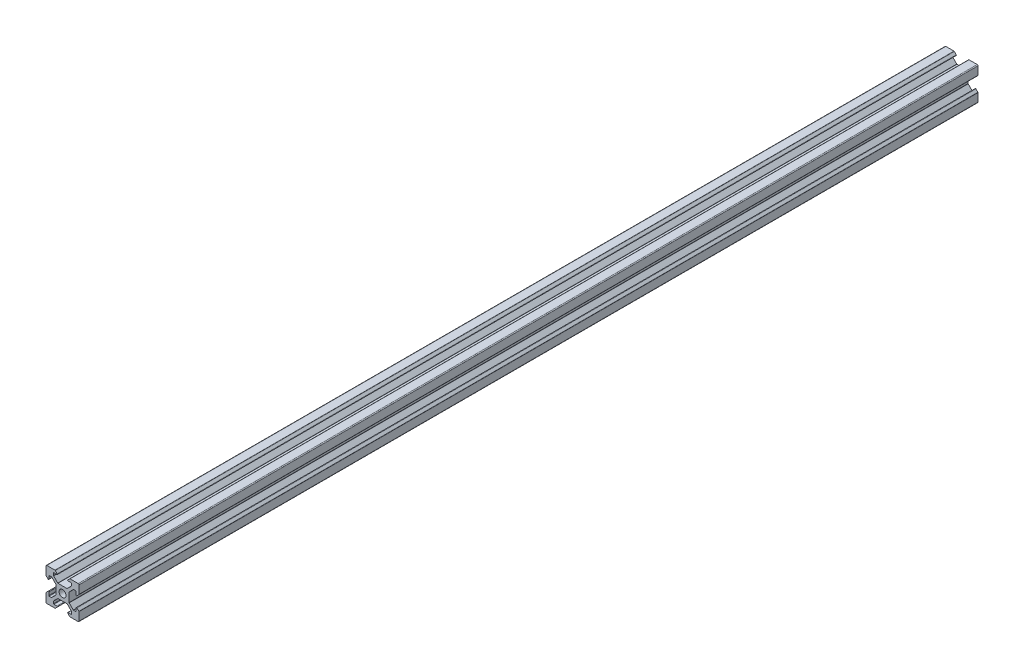
from build123d import *

# Parameters (mm, degrees)
MODEL_R             = 2.1
BOSS_EXTRUDE1_DEPTH = 545


with BuildPart() as part:
    # Model → Boss-Extrude1 (new body)
    with BuildSketch(Plane.XY):
        with BuildLine():
            Line((2012.931211125, 1381.800393717), (2012.931211125, 1378.200393717))
            Line((2012.931211125, 1378.200393717), (2012.931211125, 1377.300429431))
            ThreePointArc((2012.931211125, 1377.300429431), (2012.908374985, 1377.185624401), (2012.843343159, 1377.088297396))
            Line((2012.843343159, 1377.088297396), (2010.378662785, 1374.623617022))
            ThreePointArc((2010.378662785, 1374.623617022), (2010.297556948, 1374.569423834), (2010.20188609, 1374.550393717))
            Line((2010.20188609, 1374.550393717), (2008.881211125, 1374.550393717))
            ThreePointArc((2008.881211125, 1374.550393717), (2008.70443443, 1374.623617022), (2008.631211125, 1374.800393717))
            Line((2008.631211125, 1374.800393717), (2008.631211125, 1376.650393717))
            ThreePointArc((2008.631211125, 1376.650393717), (2008.476881983, 1376.8813636), (2008.20443443, 1376.827170412))
            Line((2008.20443443, 1376.827170412), (2007.01907909, 1375.641815073))
            ThreePointArc((2007.01907909, 1375.641815073), (2006.954047265, 1375.544488069), (2006.931211125, 1375.429683039))
            Line((2006.931211125, 1375.429683039), (2006.931211125, 1370.500393717))
            ThreePointArc((2006.931211125, 1370.500393717), (2007.077657734, 1370.146840327), (2007.431211125, 1370.000393717))
            Line((2007.431211125, 1370.000393717), (2012.360500447, 1370.000393717))
            ThreePointArc((2012.360500447, 1370.000393717), (2012.475305476, 1370.023229857), (2012.572632481, 1370.088261683))
            Line((2012.572632481, 1370.088261683), (2013.75798782, 1371.273617022))
            ThreePointArc((2013.75798782, 1371.273617022), (2013.812181008, 1371.546064575), (2013.581211125, 1371.700393717))
            Line((2013.581211125, 1371.700393717), (2011.731211125, 1371.700393717))
            ThreePointArc((2011.731211125, 1371.700393717), (2011.55443443, 1371.773617022), (2011.481211125, 1371.950393717))
            Line((2011.481211125, 1371.950393717), (2011.481211125, 1373.271068682))
            ThreePointArc((2011.481211125, 1373.271068682), (2011.500241242, 1373.36673954), (2011.55443443, 1373.447845377))
            Line((2011.55443443, 1373.447845377), (2014.033759465, 1375.927170412))
            ThreePointArc((2014.033759465, 1375.927170412), (2014.114865302, 1375.9813636), (2014.21053616, 1376.000393717))
            Line((2014.21053616, 1376.000393717), (2016.470233902, 1376.000393717))
            Line((2016.470233902, 1376.000393717), (2017.392188348, 1376.000393717))
            Line((2017.392188348, 1376.000393717), (2019.65188609, 1376.000393717))
            ThreePointArc((2019.65188609, 1376.000393717), (2019.747556948, 1375.9813636), (2019.828662785, 1375.927170412))
            Line((2019.828662785, 1375.927170412), (2022.30798782, 1373.447845377))
            ThreePointArc((2022.30798782, 1373.447845377), (2022.362181008, 1373.36673954), (2022.381211125, 1373.271068682))
            Line((2022.381211125, 1373.271068682), (2022.381211125, 1371.950393717))
            ThreePointArc((2022.381211125, 1371.950393717), (2022.30798782, 1371.773617022), (2022.131211125, 1371.700393717))
            Line((2022.131211125, 1371.700393717), (2020.281211125, 1371.700393717))
            ThreePointArc((2020.281211125, 1371.700393717), (2020.050241242, 1371.546064575), (2020.10443443, 1371.273617022))
            Line((2020.10443443, 1371.273617022), (2021.289789769, 1370.088261683))
            ThreePointArc((2021.289789769, 1370.088261683), (2021.387116773, 1370.023229857), (2021.501921803, 1370.000393717))
            Line((2021.501921803, 1370.000393717), (2026.431211125, 1370.000393717))
            ThreePointArc((2026.431211125, 1370.000393717), (2026.784764515, 1370.146840327), (2026.931211125, 1370.500393717))
            Line((2026.931211125, 1370.500393717), (2026.931211125, 1375.429683039))
            ThreePointArc((2026.931211125, 1375.429683039), (2026.908374985, 1375.544488069), (2026.843343159, 1375.641815073))
            Line((2026.843343159, 1375.641815073), (2025.65798782, 1376.827170412))
            ThreePointArc((2025.65798782, 1376.827170412), (2025.385540267, 1376.8813636), (2025.231211125, 1376.650393717))
            Line((2025.231211125, 1376.650393717), (2025.231211125, 1374.800393717))
            ThreePointArc((2025.231211125, 1374.800393717), (2025.15798782, 1374.623617022), (2024.981211125, 1374.550393717))
            Line((2024.981211125, 1374.550393717), (2023.66053616, 1374.550393717))
            ThreePointArc((2023.66053616, 1374.550393717), (2023.564865302, 1374.569423834), (2023.483759465, 1374.623617022))
            Line((2023.483759465, 1374.623617022), (2021.00443443, 1377.102942057))
            ThreePointArc((2021.00443443, 1377.102942057), (2020.950241242, 1377.184047894), (2020.931211125, 1377.279718752))
            Line((2020.931211125, 1377.279718752), (2020.931211125, 1379.539416494))
            Line((2020.931211125, 1379.539416494), (2020.931211125, 1380.46137094))
            Line((2020.931211125, 1380.46137094), (2020.931211125, 1382.721068682))
            ThreePointArc((2020.931211125, 1382.721068682), (2020.950241242, 1382.81673954), (2021.00443443, 1382.897845377))
            Line((2021.00443443, 1382.897845377), (2023.483759465, 1385.377170412))
            ThreePointArc((2023.483759465, 1385.377170412), (2023.564865302, 1385.4313636), (2023.66053616, 1385.450393717))
            Line((2023.66053616, 1385.450393717), (2024.981211125, 1385.450393717))
            ThreePointArc((2024.981211125, 1385.450393717), (2025.15798782, 1385.377170412), (2025.231211125, 1385.200393717))
            Line((2025.231211125, 1385.200393717), (2025.231211125, 1383.350393717))
            ThreePointArc((2025.231211125, 1383.350393717), (2025.385540267, 1383.119423834), (2025.65798782, 1383.173617022))
            Line((2025.65798782, 1383.173617022), (2026.843343159, 1384.358972361))
            ThreePointArc((2026.843343159, 1384.358972361), (2026.908374985, 1384.456299366), (2026.931211125, 1384.571104395))
            Line((2026.931211125, 1384.571104395), (2026.931211125, 1389.500393717))
            ThreePointArc((2026.931211125, 1389.500393717), (2026.784764516, 1389.853947108), (2026.431211125, 1390.000393717))
            Line((2026.431211125, 1390.000393717), (2021.501921803, 1390.000393717))
            ThreePointArc((2021.501921803, 1390.000393717), (2021.387116773, 1389.977557577), (2021.289789769, 1389.912525752))
            Line((2021.289789769, 1389.912525752), (2020.10443443, 1388.727170413))
            ThreePointArc((2020.10443443, 1388.727170413), (2020.050241242, 1388.454722859), (2020.281211125, 1388.300393717))
            Line((2020.281211125, 1388.300393717), (2022.131211125, 1388.300393717))
            ThreePointArc((2022.131211125, 1388.300393717), (2022.30798782, 1388.227170413), (2022.381211125, 1388.050393717))
            Line((2022.381211125, 1388.050393717), (2022.381211125, 1386.729718752))
            ThreePointArc((2022.381211125, 1386.729718752), (2022.362181008, 1386.634047894), (2022.30798782, 1386.552942057))
            Line((2022.30798782, 1386.552942057), (2019.828662785, 1384.073617022))
            ThreePointArc((2019.828662785, 1384.073617022), (2019.747556948, 1384.019423834), (2019.65188609, 1384.000393717))
            Line((2019.65188609, 1384.000393717), (2017.392188348, 1384.000393717))
            Line((2017.392188348, 1384.000393717), (2016.470233902, 1384.000393717))
            Line((2016.470233902, 1384.000393717), (2014.21053616, 1384.000393717))
            ThreePointArc((2014.21053616, 1384.000393717), (2014.114865302, 1384.019423834), (2014.033759465, 1384.073617022))
            Line((2014.033759465, 1384.073617022), (2011.55443443, 1386.552942057))
            ThreePointArc((2011.55443443, 1386.552942057), (2011.500241242, 1386.634047894), (2011.481211125, 1386.729718752))
            Line((2011.481211125, 1386.729718752), (2011.481211125, 1388.050393717))
            ThreePointArc((2011.481211125, 1388.050393717), (2011.55443443, 1388.227170413), (2011.731211125, 1388.300393717))
            Line((2011.731211125, 1388.300393717), (2013.581211125, 1388.300393717))
            ThreePointArc((2013.581211125, 1388.300393717), (2013.812181008, 1388.454722859), (2013.75798782, 1388.727170413))
            Line((2013.75798782, 1388.727170413), (2012.572632481, 1389.912525752))
            ThreePointArc((2012.572632481, 1389.912525752), (2012.475305477, 1389.977557577), (2012.360500447, 1390.000393717))
            Line((2012.360500447, 1390.000393717), (2007.431211125, 1390.000393717))
            ThreePointArc((2007.431211125, 1390.000393717), (2007.077657734, 1389.853947108), (2006.931211125, 1389.500393717))
            Line((2006.931211125, 1389.500393717), (2006.931211125, 1384.571104395))
            ThreePointArc((2006.931211125, 1384.571104395), (2006.954047265, 1384.456299366), (2007.019079091, 1384.358972361))
            Line((2007.019079091, 1384.358972361), (2008.20443443, 1383.173617022))
            ThreePointArc((2008.20443443, 1383.173617022), (2008.476881983, 1383.119423834), (2008.631211125, 1383.350393717))
            Line((2008.631211125, 1383.350393717), (2008.631211125, 1385.200393717))
            ThreePointArc((2008.631211125, 1385.200393717), (2008.70443443, 1385.377170412), (2008.881211125, 1385.450393717))
            Line((2008.881211125, 1385.450393717), (2010.20188609, 1385.450393717))
            ThreePointArc((2010.20188609, 1385.450393717), (2010.297556948, 1385.4313636), (2010.378662785, 1385.377170412))
            Line((2010.378662785, 1385.377170412), (2012.843343159, 1382.912490038))
            ThreePointArc((2012.843343159, 1382.912490038), (2012.908374985, 1382.815163033), (2012.931211125, 1382.700358004))
            Line((2012.931211125, 1382.700358004), (2012.931211125, 1381.800393717))
        make_face()
        with Locations((2016.931211125, 1380.000393717)):
            Circle(MODEL_R, mode=Mode.SUBTRACT)
    extrude(amount=BOSS_EXTRUDE1_DEPTH)


solid = part.part
